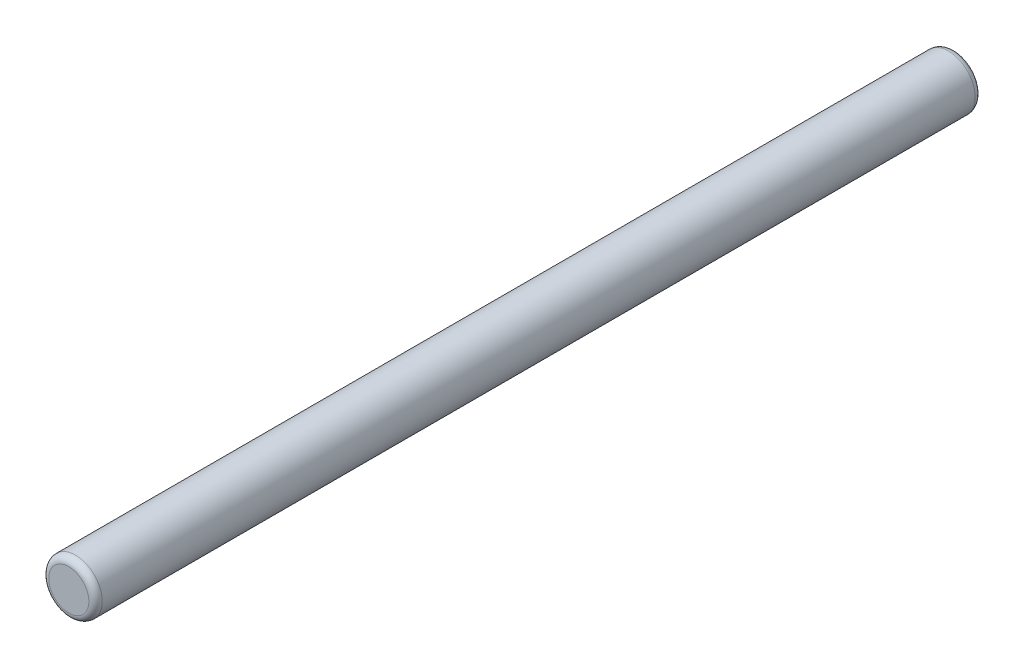
from build123d import *

# Parameters (mm, degrees)
SKETCH1_R           = 4
BOSS_EXTRUDE1_DEPTH = 132.5
FILLET1_R           = 1


with BuildPart() as part:
    # Sketch1 → Boss-Extrude1 (new body)
    with BuildSketch(Plane.XY):
        Circle(SKETCH1_R)
    extrude(amount=BOSS_EXTRUDE1_DEPTH)

    # Fillet1
    fillet1_edges = [part.edges().sort_by_distance(p)[0] for p in [
        (-4, 0, 0),
        (-4, 0, 132.5),
    ]]
    fillet(fillet1_edges, radius=FILLET1_R)


solid = part.part
